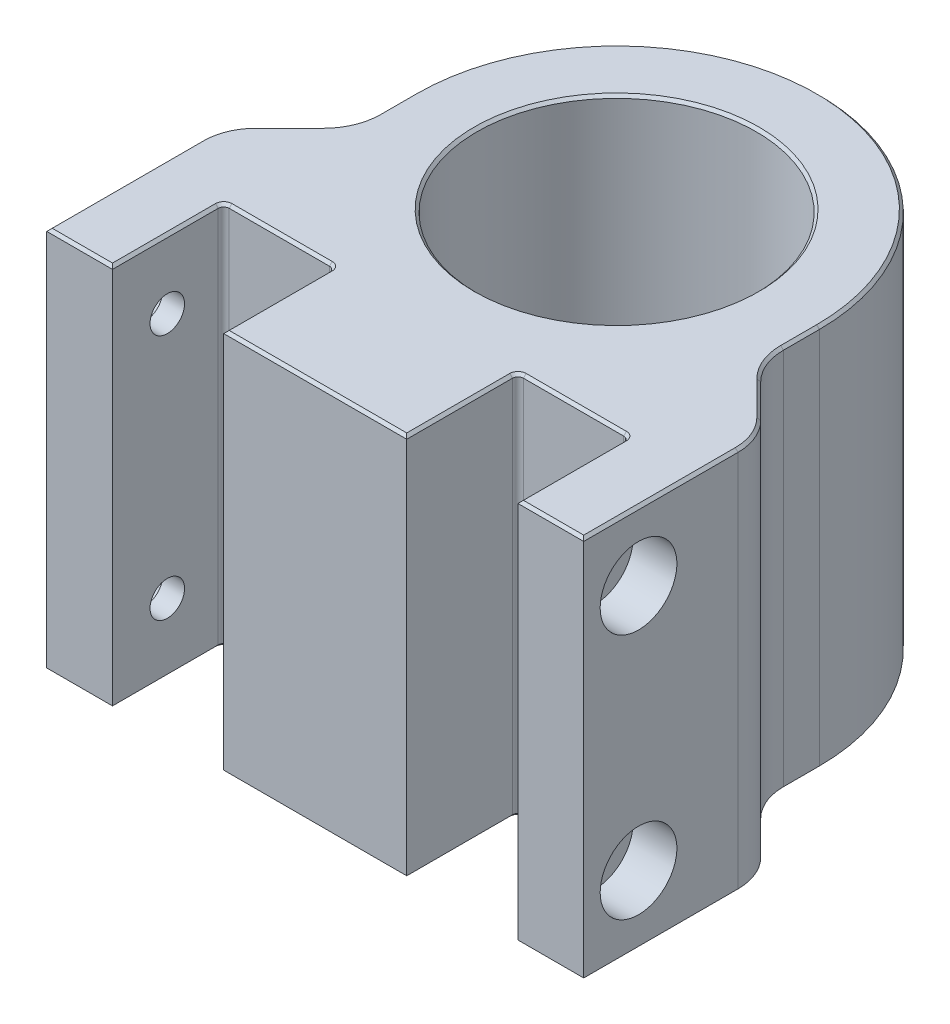
from build123d import *

# Parameters (mm, degrees)
SKETCH1_R           = 25.5
BOSS_EXTRUDE1_DEPTH = 35
SKETCH2_W           = 20.3
SKETCH2_H           = 20.3
CUT_EXTRUDE1_DEPTH  = 97.40539404
BOSS_EXTRUDE2_DEPTH = 70
SKETCH4_R           = 3.15
CUT_EXTRUDE2_DEPTH  = 20
SKETCH5_R           = 7
CUT_EXTRUDE3_DEPTH  = 8
FILLET1_R           = 1
FILLET2_R           = 10
CHAMFER1_SIZE       = 0.5


with BuildPart() as part:
    # Sketch1 → Boss-Extrude1 (new, symmetric)
    with BuildSketch(Plane(origin=(0, 0, 0), x_dir=(1, 0, 0), z_dir=(0, 1, 0))):
        with BuildLine():
            Line((-37, 0), (-37, -55))
            Line((-37, -55), (37, -55))
            Line((37, -55), (37, 0))
            ThreePointArc((37, 0), (0, 37), (-37, 0))
        make_face()
        with Locations(Location((0, 0, 0), (0, 0, 270))):
            Circle(SKETCH1_R, mode=Mode.SUBTRACT)
    extrude(amount=BOSS_EXTRUDE1_DEPTH, both=True)

    # Sketch2 → Cut-Extrude1 (cut, through all)
    with BuildSketch(Plane(origin=(0, 35, 0), x_dir=(1, 0, 0), z_dir=(0, 1, 0))):
        with Locations((-26.85, -44.85)):
            Rectangle(SKETCH2_W, SKETCH2_H)
        with Locations((26.85, -44.85)):
            Rectangle(SKETCH2_W, SKETCH2_H)
    extrude(amount=-CUT_EXTRUDE1_DEPTH, mode=Mode.SUBTRACT)

    # Sketch3 → Boss-Extrude2 (add)
    with BuildSketch(Plane(origin=(0, 35, 0), x_dir=(1, 0, 0), z_dir=(0, 1, 0))):
        Polygon((-37, -34.7), (-37, -55), (-49, -55), (-49, -22.7), (-37, -10.7), align=None)
    boss_extrude2 = extrude(amount=-BOSS_EXTRUDE2_DEPTH)

    # Sketch4 → Cut-Extrude2 (cut)
    with BuildSketch(Plane.ZY.offset(49)):
        with Locations((45, 22.5)):
            Circle(SKETCH4_R)
        with Locations((45, -22.5)):
            Circle(SKETCH4_R)
    cut_extrude2 = extrude(amount=-CUT_EXTRUDE2_DEPTH, mode=Mode.SUBTRACT)

    # Sketch5 → Cut-Extrude3 (cut)
    with BuildSketch(Plane.ZY.offset(49)):
        with Locations((45, 22.5)):
            Circle(SKETCH5_R)
        with Locations((45, -22.5)):
            Circle(SKETCH5_R)
    cut_extrude3 = extrude(amount=-CUT_EXTRUDE3_DEPTH, mode=Mode.SUBTRACT)

    # Mirror5: Boss-Extrude2, Cut-Extrude2, Cut-Extrude3 across plane
    add(boss_extrude2.mirror(Plane(origin=(0, 0, 0), x_dir=(0, 0, 1), z_dir=(1, 0, 0))))
    add(cut_extrude2.mirror(Plane(origin=(0, 0, 0), x_dir=(0, 0, 1), z_dir=(1, 0, 0))), mode=Mode.SUBTRACT)
    add(cut_extrude3.mirror(Plane(origin=(0, 0, 0), x_dir=(0, 0, 1), z_dir=(1, 0, 0))), mode=Mode.SUBTRACT)

    # Fillet1
    fillet1_edges = [part.edges().sort_by_distance(p)[0] for p in [
        (-37, 0, 34.7),
        (-16.7, 0, 34.7),
        (37, 0, 34.7),
        (16.7, 0, 34.7),
    ]]
    fillet(fillet1_edges, radius=FILLET1_R)

    # Fillet2
    fillet2_edges = [part.edges().sort_by_distance(p)[0] for p in [
        (-37, 0, 10.7),
        (-49, 0, 22.7),
        (49, 0, 22.7),
        (37, 0, 10.7),
    ]]
    fillet(fillet2_edges, radius=FILLET2_R)

    # Chamfer1
    chamfer1_edges = [part.edges().sort_by_distance(p)[0] for p in [
        (16.7, 35, 45.35),
        (16.7, -35, 45.35),
        (26.85, 35, 34.7),
        (26.85, -35, 34.7),
        (37, -35, 45.35),
        (-26.85, 35, 34.7),
        (-26.85, -35, 34.7),
        (0, -35, -25.5),
        (-37, -35, 45.35),
        (0, 35, -25.5),
        (16.992893219, 35, 34.992893219),
        (16.992893219, -35, 34.992893219),
        (36.707106781, 35, 34.992893219),
        (36.707106781, -35, 34.992893219),
        (-16.992893219, 35, 34.992893219),
        (-16.992893219, -35, 34.992893219),
        (-36.707106781, 35, 34.992893219),
        (-36.707106781, -35, 34.992893219),
        (49, 35, 40.921067812),
        (43, 35, 16.7),
        (37, 35, 3.278932188),
        (-43, 35, 16.7),
        (-49, 35, 40.921067812),
        (-48.238795325, 35, 23.0153013),
        (48.238795325, 35, 23.0153013),
        (43, -35, 16.7),
        (-43, -35, 16.7),
        (37, -35, 3.278932188),
        (-48.238795325, -35, 23.0153013),
        (48.238795325, -35, 23.0153013),
        (37.761204675, 35, 10.3846987),
        (37.761204675, -35, 10.3846987),
        (-37.761204675, 35, 10.3846987),
        (-37.761204675, -35, 10.3846987),
        (0, -35, 55),
        (0, 35, 55),
        (-16.7, -35, 45.35),
        (-16.7, 35, 45.35),
        (-37, 35, 45.35),
        (0, 35, -37),
        (-43, 35, 55),
        (-43, -35, 55),
        (-49, -35, 40.921067812),
        (-37, -35, 3.278932188),
        (0, -35, -37),
        (37, 35, 45.35),
        (43, -35, 55),
        (43, 35, 55),
        (49, -35, 40.921067812),
        (-37, 35, 3.278932188),
    ]]
    chamfer(chamfer1_edges, length=CHAMFER1_SIZE)


solid = part.part
